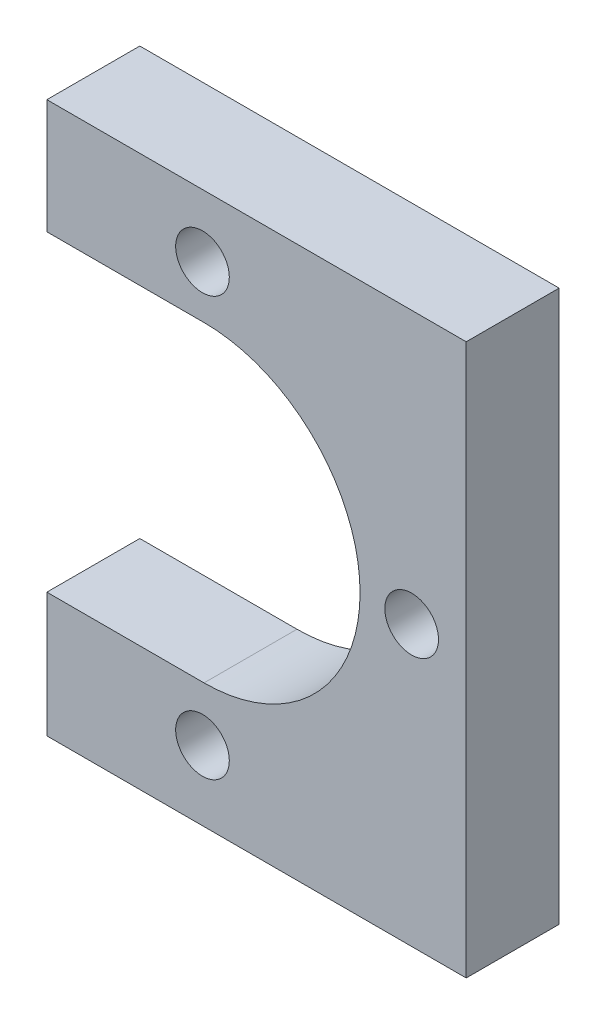
from build123d import *

# Parameters (mm, degrees)
CROQUIS1_W              = 43
CROQUIS1_H              = 56.5
SALIENTE_EXTRUIR1_DEPTH = 9.53
CORTAR_EXTRUIR1_DEPTH   = 9.53
CORTAR_EXTRUIR2_REACH   = 38.758
CROQUIS3_R              = 2.75


with BuildPart() as part:
    # Croquis1 → Saliente-Extruir1 (new body)
    with BuildSketch(Plane.XY):
        Rectangle(CROQUIS1_W, CROQUIS1_H)
    extrude(amount=SALIENTE_EXTRUIR1_DEPTH)

    # Croquis2 → Cortar-Extruir1 (cut)
    with BuildSketch(Plane.XY.offset(9.53)):
        with BuildLine():
            ThreePointArc((-5.384, -15.485), (10.616, 0.515), (-5.384, 16.515))
            Line((-5.384, 16.515), (-21.5, 16.515))
            Line((-21.5, 16.515), (-21.5, -15.485))
            Line((-21.5, -15.485), (-5.384, -15.485))
        make_face()
    extrude(amount=-CORTAR_EXTRUIR1_DEPTH, mode=Mode.SUBTRACT)

    # Croquis3 → Cortar-Extruir2 (cut, up to next)
    with BuildSketch(Plane.XY.offset(9.53), mode=Mode.PRIVATE) as cortar_extruir2_sk1:
        with Locations((15.908, 0.383)):
            Circle(CROQUIS3_R)
    cortar_extruir2_tool1 = extrude(cortar_extruir2_sk1.sketch, amount=-CORTAR_EXTRUIR2_REACH, mode=Mode.PRIVATE) & part.part
    # Croquis3 → Cortar-Extruir2 (cut, up to next)
    with BuildSketch(Plane.XY.offset(9.53), mode=Mode.PRIVATE) as cortar_extruir2_sk2:
        with Locations((-5.542, 21.833)):
            Circle(CROQUIS3_R)
    cortar_extruir2_tool2 = extrude(cortar_extruir2_sk2.sketch, amount=-CORTAR_EXTRUIR2_REACH, mode=Mode.PRIVATE) & part.part
    # Croquis3 → Cortar-Extruir2 (cut, up to next)
    with BuildSketch(Plane.XY.offset(9.53), mode=Mode.PRIVATE) as cortar_extruir2_sk3:
        with Locations((-5.542, -21.105)):
            Circle(CROQUIS3_R)
    cortar_extruir2_tool3 = extrude(cortar_extruir2_sk3.sketch, amount=-CORTAR_EXTRUIR2_REACH, mode=Mode.PRIVATE) & part.part
    add(cortar_extruir2_tool1.solids().sort_by_distance((15.908, 0.383, 9.53))[0], mode=Mode.SUBTRACT)
    add(cortar_extruir2_tool2.solids().sort_by_distance((-5.542, 21.833, 9.53))[0], mode=Mode.SUBTRACT)
    add(cortar_extruir2_tool3.solids().sort_by_distance((-5.542, -21.105, 9.53))[0], mode=Mode.SUBTRACT)


solid = part.part
